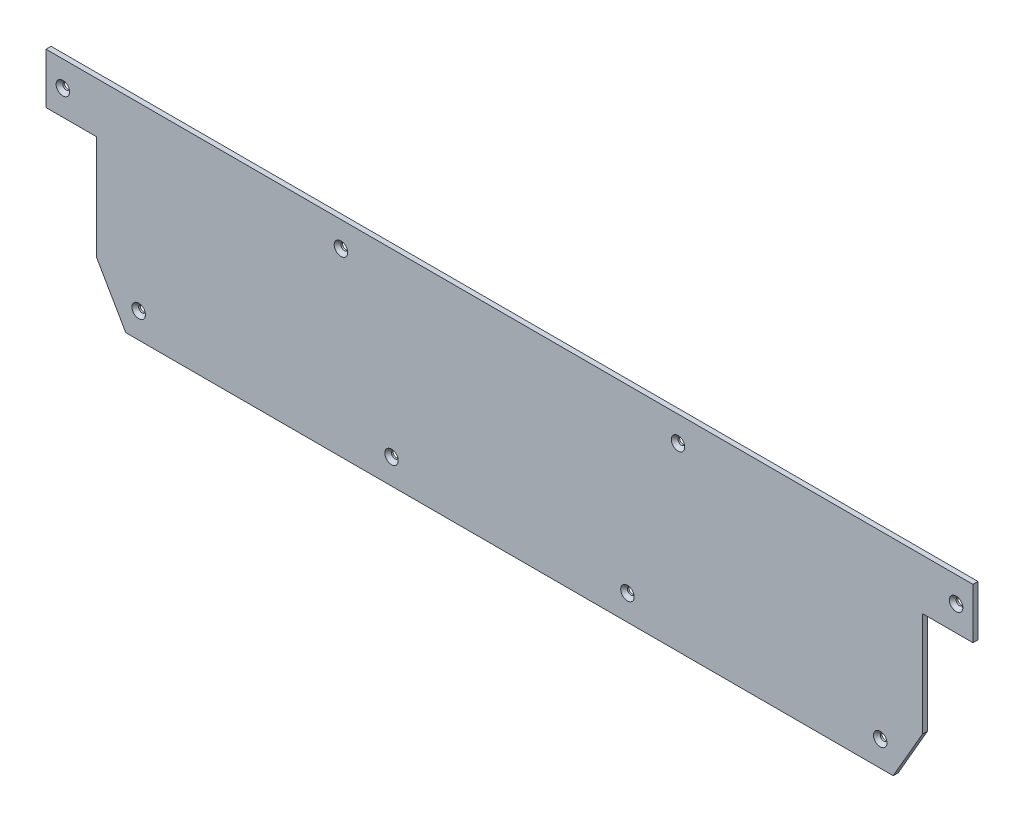
from build123d import *

# Parameters (mm, degrees)
SKETCH_1_W          = 550
SKETCH_1_H          = 122
EXTRUDE_1_DEPTH     = 3
CUT_EXTRUDE_2_DEPTH = 282.700195243
SKETCH_2_R          = 2
CUT_EXTRUDE_1_DEPTH = 10
CHAMFER_1_SIZE      = 2


with BuildPart() as part:
    # 草图1 → 凸台-拉伸1 (new body)
    with BuildSketch(Plane.XY):
        Rectangle(SKETCH_1_W, SKETCH_1_H)
    extrude(amount=EXTRUDE_1_DEPTH)

    # 草图3 → 切除-拉伸2 (cut, through all)
    with BuildSketch(Plane.XY.offset(3)):
        Polygon((-275, 31), (-245, 31), (-245, -31), (-227.679491924, -61), (-275, -61), align=None)
        Polygon((245, -31), (227.679491924, -61), (275, -61), (275, 31), (245, 31), align=None)
    extrude(amount=-CUT_EXTRUDE_2_DEPTH, mode=Mode.SUBTRACT)

    # 草图2 → 切除-拉伸1 (cut)
    with BuildSketch(Plane.XY):
        with Locations((-100, 46)):
            Circle(SKETCH_2_R)
        with Locations((-265, 46)):
            Circle(SKETCH_2_R)
        with Locations(Location((265, 46, 0), (0, 0, 180))):
            Circle(SKETCH_2_R)
        with Locations(Location((100, 46, 0), (0, 0, 180))):
            Circle(SKETCH_2_R)
        with Locations((-220, -46)):
            Circle(SKETCH_2_R)
        with Locations((-70, -46)):
            Circle(SKETCH_2_R)
        with Locations(Location((70, -46, 0), (0, 0, 180))):
            Circle(SKETCH_2_R)
        with Locations(Location((220, -46, 0), (0, 0, 180))):
            Circle(SKETCH_2_R)
    extrude(amount=CUT_EXTRUDE_1_DEPTH, mode=Mode.SUBTRACT)

    # 倒角1
    chamfer_1_edges = [part.edges().sort_by_distance(p)[0] for p in [
        (-222, -46, 3),
        (102, 46, 3),
        (267, 46, 3),
        (-267, 46, 3),
        (-72, -46, 3),
        (72, -46, 3),
        (222, -46, 3),
        (-102, 46, 3),
    ]]
    chamfer(chamfer_1_edges, length=CHAMFER_1_SIZE)


solid = part.part
